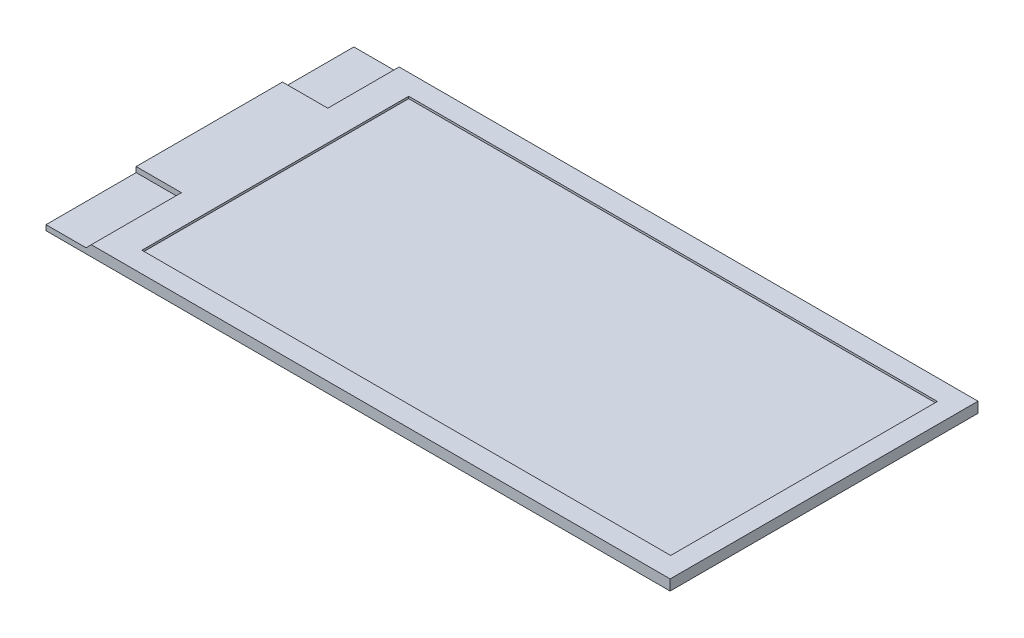
from build123d import *

# Parameters (mm, degrees)
SKETCH1_W           = 59.2
SKETCH1_H           = 29.2
BOSS_EXTRUDE1_DEPTH = 1
SKETCH2_W           = 50.15
SKETCH2_H           = 25.3
CUT_EXTRUDE1_DEPTH  = 0.2
CUT_EXTRUDE2_DEPTH  = 42.590864381
SKETCH4_W           = 13.88
SKETCH4_H           = 0.707068884
BOSS_EXTRUDE2_DEPTH = 4.5


with BuildPart() as part:
    # Sketch1 → Boss-Extrude1 (new body)
    with BuildSketch(Plane(origin=(0, 0, 0), x_dir=(1, 0, 0), z_dir=(0, 1, 0))):
        Rectangle(SKETCH1_W, SKETCH1_H)
    extrude(amount=BOSS_EXTRUDE1_DEPTH)

    # Sketch2 → Cut-Extrude1 (cut)
    with BuildSketch(Plane(origin=(0, 1, 0), x_dir=(1, 0, 0), z_dir=(0, 1, 0))):
        with Locations((2.625, 0)):
            Rectangle(SKETCH2_W, SKETCH2_H)
    extrude(amount=-CUT_EXTRUDE1_DEPTH, mode=Mode.SUBTRACT)

    # Sketch3 → Cut-Extrude2 (cut, through all)
    with BuildSketch(Plane.XY.offset(14.6)):
        Polygon((-29.6, 0.5), (-25.80413761, 0.5), (-25.30413761, 1), (-29.6, 1), align=None)
    extrude(amount=-CUT_EXTRUDE2_DEPTH, mode=Mode.SUBTRACT)

    # Sketch4 → Boss-Extrude2 (add)
    with BuildSketch(Plane.ZY.offset(29.6)):
        with Locations((-0.89, 0.646465558)):
            Rectangle(SKETCH4_W, SKETCH4_H)
    extrude(amount=-BOSS_EXTRUDE2_DEPTH)


solid = part.part
